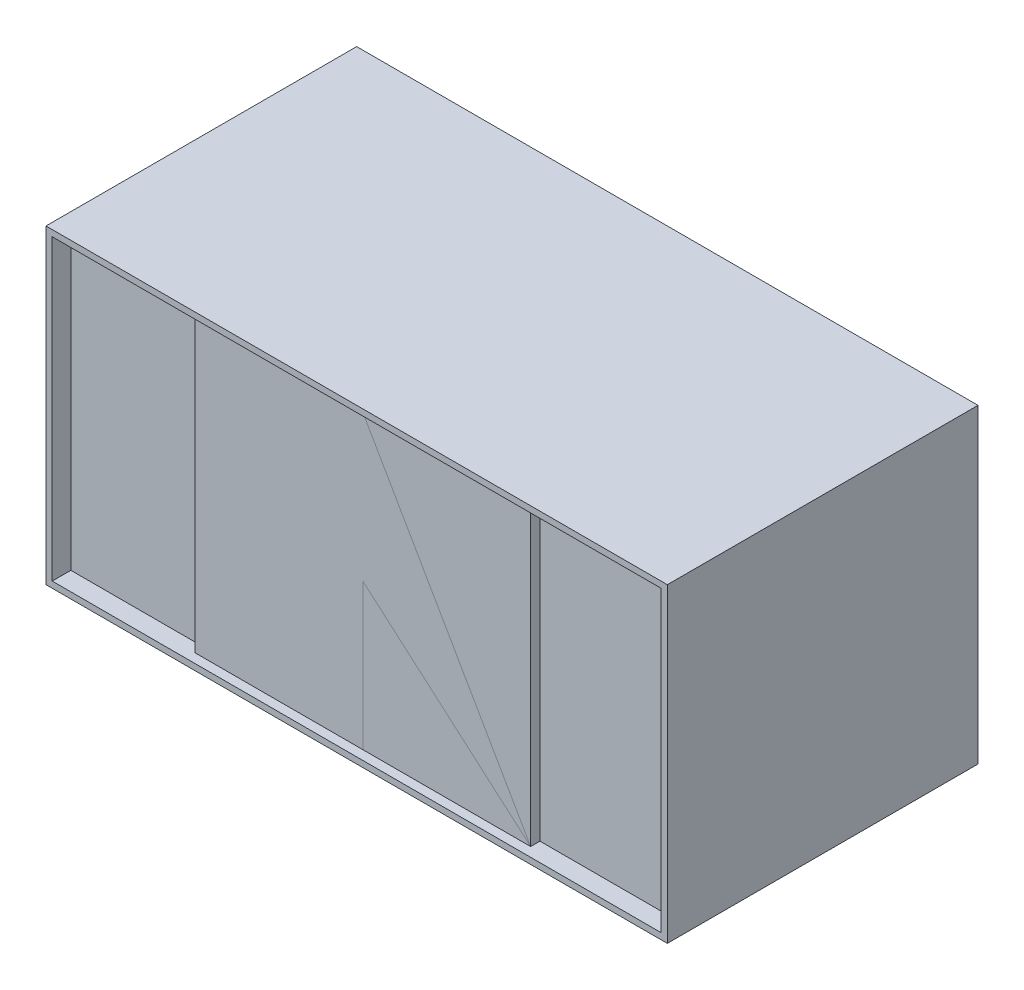
from build123d import *

# Parameters (mm, degrees)
ESBO_O1_W                = 1000
ESBO_O1_H                = 500
RESSALTO_EXTRUS_O1_DEPTH = 250
CASCA1_T                 = -10
ESBO_O3_W                = 400
ESBO_O3_H                = 400
CORTE_EXTRUS_O5_DEPTH    = 250
ESBO_O21_W               = 270
ESBO_O21_H               = 480
RESSALTO_EXTRUS_O3_DEPTH = 10
PADR_O_LINEAR1_COUNT     = 2
PADR_O_LINEAR1_PITCH     = 710
ESBO_O24_R               = 4
CORTE_EXTRUS_O7_DEPTH    = 25
ESBO_O34_W               = 460
ESBO_O34_H               = 500
RESSALTO_EXTRUS_O6_DEPTH = 10
ESBO_O35_W               = 450
ESBO_O35_H               = 480
RESSALTO_EXTRUS_O7_DEPTH = 10
ESBO_O36_W               = 270
ESBO_O36_H               = 470
RESSALTO_EXTRUS_O8_DEPTH = 15


with BuildPart() as part:
    # Esboço1 → Ressalto-extrusão1 (new, symmetric)
    with BuildSketch(Plane.XY):
        Rectangle(ESBO_O1_W, ESBO_O1_H)
    extrude(amount=RESSALTO_EXTRUS_O1_DEPTH, both=True)

    # Casca1
    casca1_openings = [part.faces().sort_by_distance(p)[0] for p in [
        (0, 0, 250),
    ]]
    offset(amount=CASCA1_T, openings=casca1_openings, kind=Kind.INTERSECTION)

    # Esboço3 → Corte-extrusão5 (cut, symmetric)
    with BuildSketch(Plane(origin=(0, 0, -250), x_dir=(-1, 0, 0), z_dir=(0, 0, -1))):
        Rectangle(ESBO_O3_W, ESBO_O3_H)
    extrude(amount=CORTE_EXTRUS_O5_DEPTH, both=True, mode=Mode.SUBTRACT)

    # Esboço21 → Ressalto-extrusão3 (add)
    with BuildSketch(Plane.XY.offset(210)):
        with Locations((-355, 0)):
            Rectangle(ESBO_O21_W, ESBO_O21_H)
    ressalto_extrus_o3 = extrude(amount=RESSALTO_EXTRUS_O3_DEPTH)

    # Padrão linear1: Ressalto-extrusão3 ×2
    with Locations(*[(i * PADR_O_LINEAR1_PITCH, 0, 0) for i in range(1, PADR_O_LINEAR1_COUNT)]):
        add(ressalto_extrus_o3)

    # Esboço24 → Corte-extrusão7 (cut, symmetric)
    with BuildSketch(Plane.XY.offset(220)):
        with Locations((-260, -220)):
            Circle(ESBO_O24_R)
    extrude(amount=CORTE_EXTRUS_O7_DEPTH, both=True, mode=Mode.SUBTRACT)

    # Esboço34 → Ressalto-extrusão6 (add)
    with BuildSketch(Plane(origin=(-250, 0, 0), x_dir=(0, 0, -1), z_dir=(1, 0, 0))):
        with Locations((20, 0)):
            Rectangle(ESBO_O34_W, ESBO_O34_H)
    extrude(amount=-RESSALTO_EXTRUS_O6_DEPTH)

    # Esboço35 → Ressalto-extrusão7 (add)
    with BuildSketch(Plane(origin=(250, 0, 0), x_dir=(0, 0, -1), z_dir=(1, 0, 0))):
        with Locations((15, 0)):
            Rectangle(ESBO_O35_W, ESBO_O35_H)
    extrude(amount=RESSALTO_EXTRUS_O7_DEPTH)


with BuildPart() as body_2:
    # Esboço36 → Ressalto-extrusão8 (new body)
    with BuildSketch(Plane.XY.offset(225)):
        with Locations((-135, 0)):
            Rectangle(ESBO_O36_W, ESBO_O36_H)
    ressalto_extrus_o8 = extrude(amount=RESSALTO_EXTRUS_O8_DEPTH)


with BuildPart() as body_3:
    # Espelhar5: mirrored copy
    add(body_2.part.mirror(Plane(origin=(0, -235, 240), x_dir=(0, 0, 1), z_dir=(-1, 0, 0))))


with BuildPart() as body_2_1:
    add(body_2.part)

    # Espelhar4: Ressalto-extrusão8 across plane
    add(ressalto_extrus_o8.mirror(Plane(origin=(0, -235, 240), x_dir=(0, 0, 1), z_dir=(-1, 0, 0))))


solid = Compound([part.part, body_3.part, body_2_1.part])
